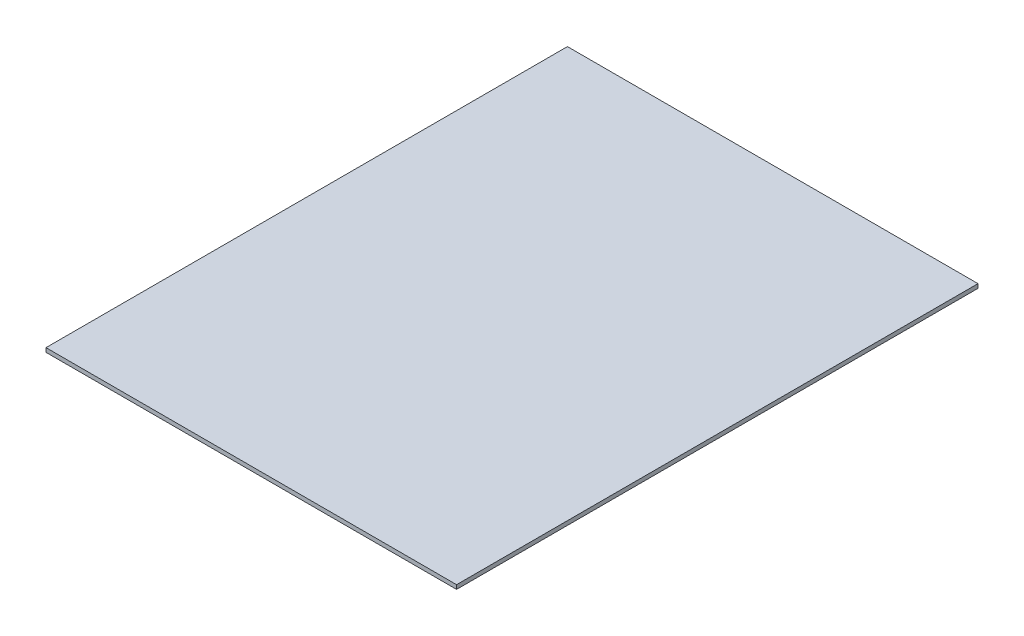
from build123d import *

# Parameters (mm, degrees)
SKETCH1_W           = 300
SKETCH1_H           = 381
BOSS_EXTRUDE1_DEPTH = 3


with BuildPart() as part:
    # Sketch1 → Boss-Extrude1 (new body)
    with BuildSketch(Plane(origin=(0, 0, 0), x_dir=(1, 0, 0), z_dir=(0, 1, 0))):
        Rectangle(SKETCH1_W, SKETCH1_H)
    extrude(amount=BOSS_EXTRUDE1_DEPTH)


solid = part.part
